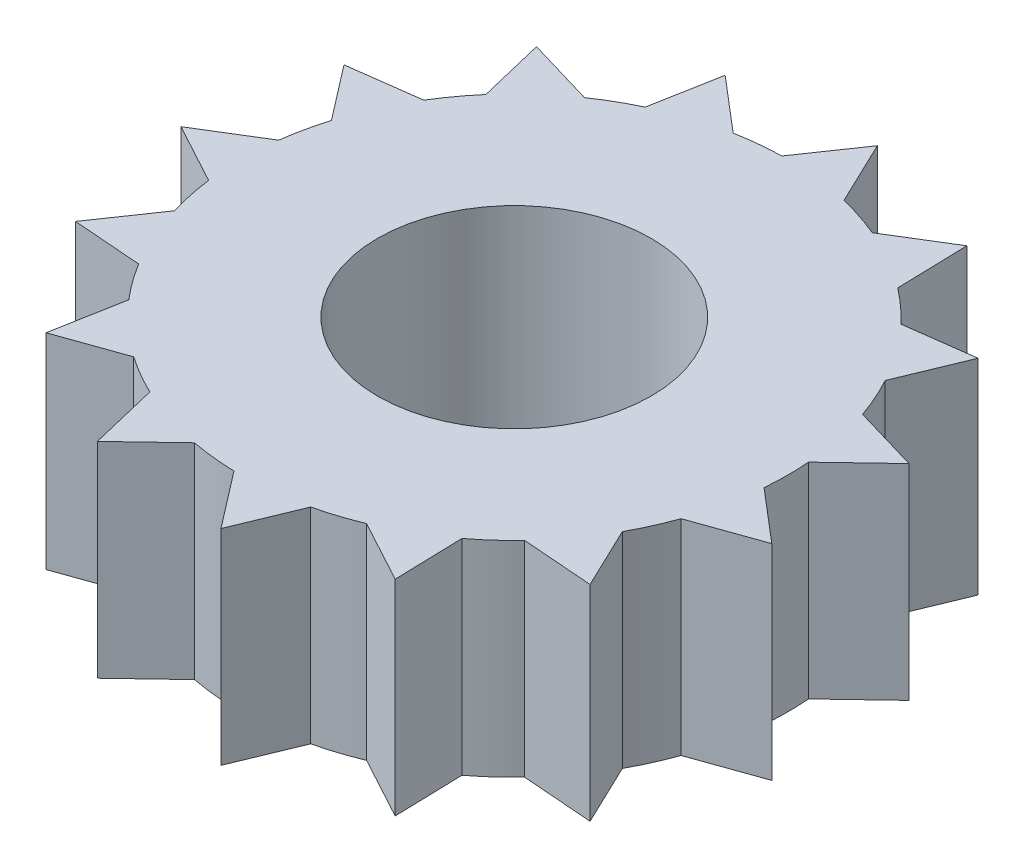
from build123d import *

# Parameters (mm, degrees)
SKETCH_16_W              = 20
SKETCH_16_H              = 30
EXTRUDE_2_DEPTH          = 30
PATTERN_CIRCULAR_3_COUNT = 15


with BuildPart() as part:
    # 草图16 → 旋转5 (revolve)
    with BuildSketch(Plane.XY, mode=Mode.PRIVATE) as revolve_5_sk:
        with Locations((-30.151216768, 15)):
            Rectangle(SKETCH_16_W, SKETCH_16_H)
    revolve(revolve_5_sk.sketch.rotate(Axis((-0.151216768, 0, 0), (0, 1, 0)), 270), axis=Axis((-0.151216768, 0, 0), (0, 1, 0)))

    # 草图17 → 凸台-拉伸2 (add, through all)
    with BuildSketch(Plane(origin=(0, 30, 0), x_dir=(1, 0, 0), z_dir=(0, 1, 0))):
        with BuildLine():
            Line((-48.6676208, -0.245209253), (-39.833774171, -5.029377496))
            ThreePointArc((-39.833774171, -5.029377496), (-40.151130439, 0.083104397), (-39.81253347, 5.194223472))
            Line((-39.81253347, 5.194223472), (-48.6676208, -0.245209253))
        make_face()
    extrude_2 = extrude(amount=-EXTRUDE_2_DEPTH)

    # 阵列(圆周)3: 凸台-拉伸2 ×15 about axis
    pattern_circular_3_axis = Axis((-0.151216768, 0, 0), (0, 1, 0))
    for i in range(1, PATTERN_CIRCULAR_3_COUNT):
        add(extrude_2.rotate(pattern_circular_3_axis, i * 360 / PATTERN_CIRCULAR_3_COUNT))


solid = part.part
